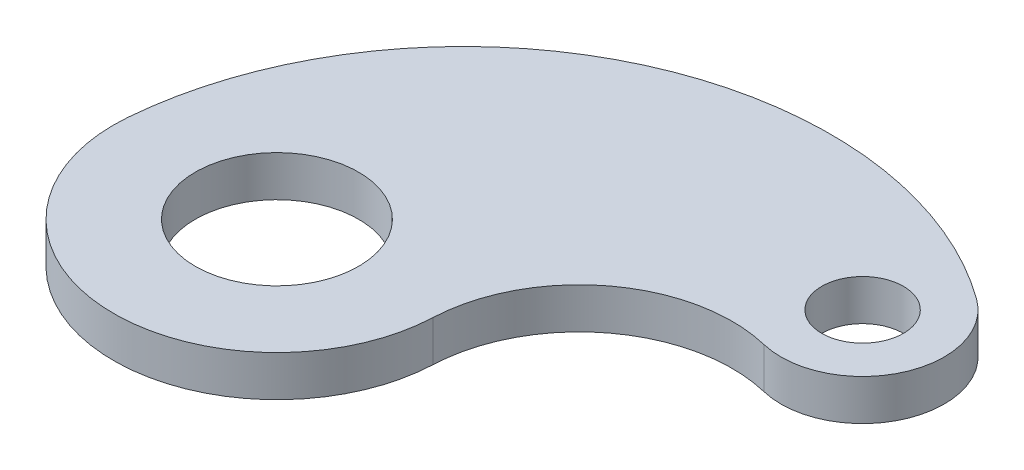
from build123d import *

# Parameters (mm, degrees)
SALIENTE_EXTRUIR1_DEPTH      = 10
SALIENTE_EXTRUIR1_DEPTH_BACK = 10
CROQUIS2_R                   = 40
CROQUIS2_R_2                 = 20


with BuildPart() as part:
    # Croquis2 → Saliente-Extruir1 (new, two sides: drawn at the far end of the back side and taken through both)
    with BuildSketch(Plane(origin=(0, 0, 0), x_dir=(1, 0, 0), z_dir=(0, 1, 0)).offset(-SALIENTE_EXTRUIR1_DEPTH_BACK)):
        with BuildLine():
            ThreePointArc((172.469235199, 66.119242389), (218.184271838, 88.238889892), (205.354467187, 137.376853761))
            ThreePointArc((205.354467187, 137.376853761), (24.626451497, 155.299352148), (-79.722697138, 6.655190531))
            ThreePointArc((-79.722697138, 6.655190531), (-5.078826092, -79.838621766), (79.923379849, -3.500479035))
            ThreePointArc((79.923379849, -3.500479035), (109.764419077, 53.152375878), (172.469235199, 66.119242389))
        make_face()
        Circle(CROQUIS2_R, mode=Mode.SUBTRACT)
        with Locations((181.865334795, 105)):
            Circle(CROQUIS2_R_2, mode=Mode.SUBTRACT)
    extrude(amount=SALIENTE_EXTRUIR1_DEPTH + SALIENTE_EXTRUIR1_DEPTH_BACK)


solid = part.part
